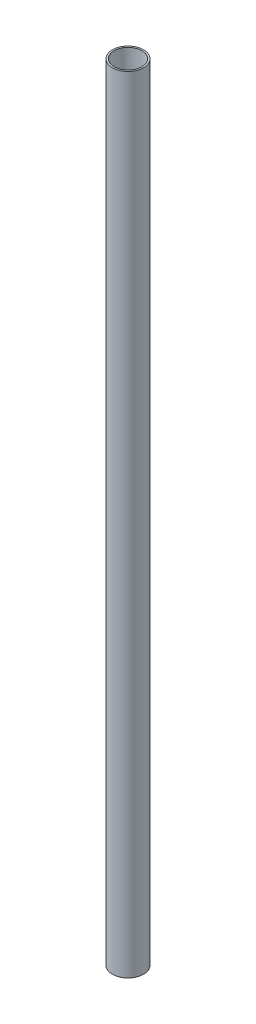
from build123d import *

# Parameters (mm, degrees)
SKETCH1_R           = 30.226
SKETCH1_R_2         = 27.051
BOSS_EXTRUDE1_DEPTH = 1524


with BuildPart() as part:
    # Sketch1 → Boss-Extrude1 (new body)
    with BuildSketch(Plane(origin=(0, 0, 0), x_dir=(1, 0, 0), z_dir=(0, 1, 0))):
        with Locations(Location((0, 0, 0), (0, 0, 270))):
            Circle(SKETCH1_R)
        with Locations(Location((0, 0, 0), (0, 0, 270))):
            Circle(SKETCH1_R_2, mode=Mode.SUBTRACT)
    extrude(amount=BOSS_EXTRUDE1_DEPTH)


solid = part.part
